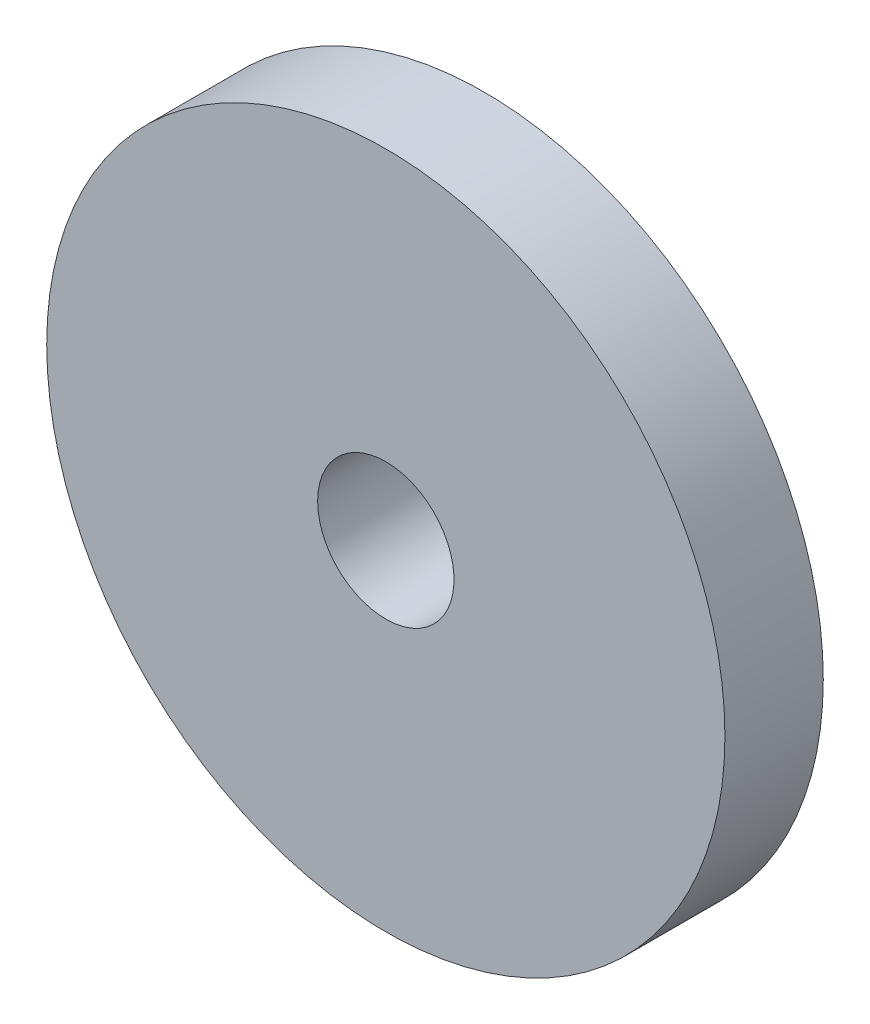
from build123d import *

# Parameters (mm, degrees)
SKETCH1_R           = 16.4211
SKETCH1_R_2         = 3.302
BOSS_EXTRUDE1_DEPTH = 4.7625


with BuildPart() as part:
    # Sketch1 → Boss-Extrude1 (new body)
    with BuildSketch(Plane.XY):
        with Locations(Location((0, 0, 0), (0, 0, 180))):
            Circle(SKETCH1_R)
        with Locations(Location((0, 0, 0), (0, 0, 180))):
            Circle(SKETCH1_R_2, mode=Mode.SUBTRACT)
    extrude(amount=BOSS_EXTRUDE1_DEPTH)


solid = part.part
